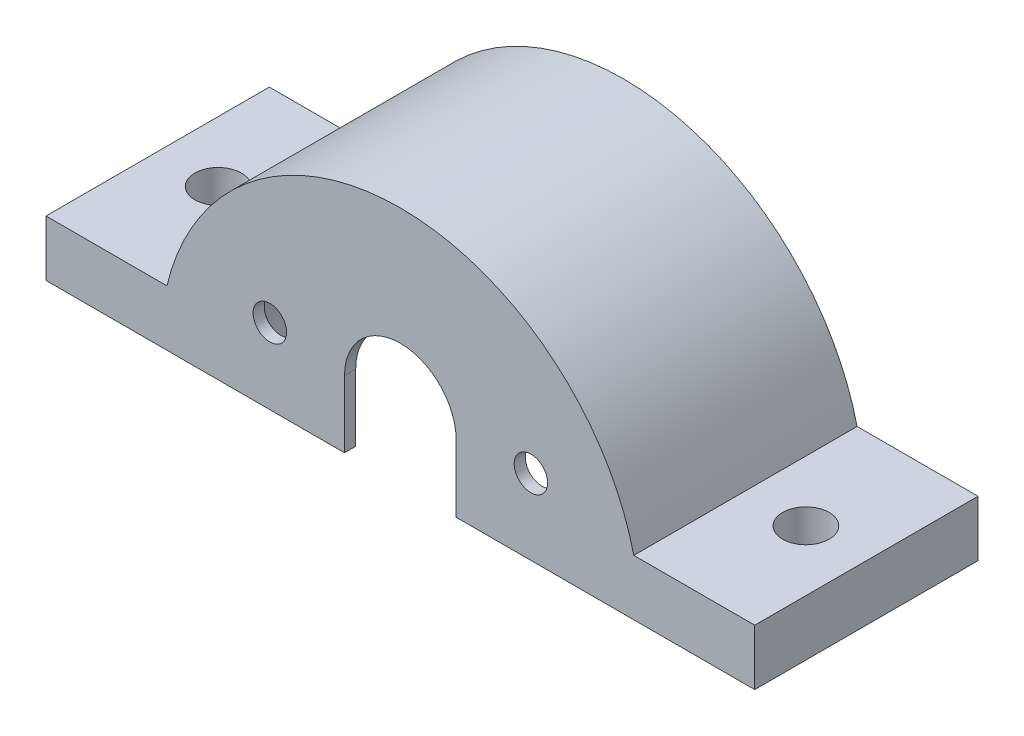
from build123d import *

# Parameters (mm, degrees)
BOSS_EXTRUDE1_DEPTH = 20
BOSS_EXTRUDE2_START = -1
BOSS_EXTRUDE2_DEPTH = 1
SKETCH3_R           = 1.5
CUT_EXTRUDE1_DEPTH  = 44.239768732
SKETCH4_R           = 2.0828
CUT_EXTRUDE2_DEPTH  = 41.983869998


with BuildPart() as part:
    # Sketch1 → Boss-Extrude1 (new body)
    with BuildSketch(Plane.XY):
        with BuildLine():
            Line((-16.5, 0), (-31.74, 0))
            Line((-31.74, 0), (-31.74, 5))
            Line((-31.74, 5), (-20.910523666, 5))
            ThreePointArc((-20.910523666, 5), (0, 21.5), (20.910523666, 5))
            Line((20.910523666, 5), (31.74, 5))
            Line((31.74, 5), (31.74, 0))
            Line((31.74, 0), (16.5, 0))
            ThreePointArc((16.5, 0), (0, 16.5), (-16.5, 0))
        make_face()
    extrude(amount=BOSS_EXTRUDE1_DEPTH)

    # Sketch2 → Boss-Extrude2 (add)
    with BuildSketch(Plane.XY.offset(20).offset(BOSS_EXTRUDE2_START)):
        with BuildLine():
            Line((5, 0), (16.5, 0))
            ThreePointArc((16.5, 0), (0, 16.5), (-16.5, 0))
            Line((-16.5, 0), (-5, 0))
            Line((-5, 0), (-5, 6))
            ThreePointArc((-5, 6), (0, 11), (5, 6))
            Line((5, 6), (5, 0))
        make_face()
    extrude(amount=BOSS_EXTRUDE2_DEPTH)

    # Sketch3 → Cut-Extrude1 (cut, through all)
    with BuildSketch(Plane.XY.offset(20)):
        with Locations((-11.691342951, 6.75)):
            Circle(SKETCH3_R)
        with Locations((11.691342951, 6.75)):
            Circle(SKETCH3_R)
    extrude(amount=-CUT_EXTRUDE1_DEPTH, mode=Mode.SUBTRACT)

    # Sketch4 → Cut-Extrude2 (cut, through all)
    with BuildSketch(Plane(origin=(0, 5, 0), x_dir=(1, 0, 0), z_dir=(0, 1, 0))):
        with Locations(Location((26.325261833, -10, 0), (0, 0, 180))):
            Circle(SKETCH4_R)
        with Locations((-26.325261833, -10)):
            Circle(SKETCH4_R)
    extrude(amount=-CUT_EXTRUDE2_DEPTH, mode=Mode.SUBTRACT)


solid = part.part
